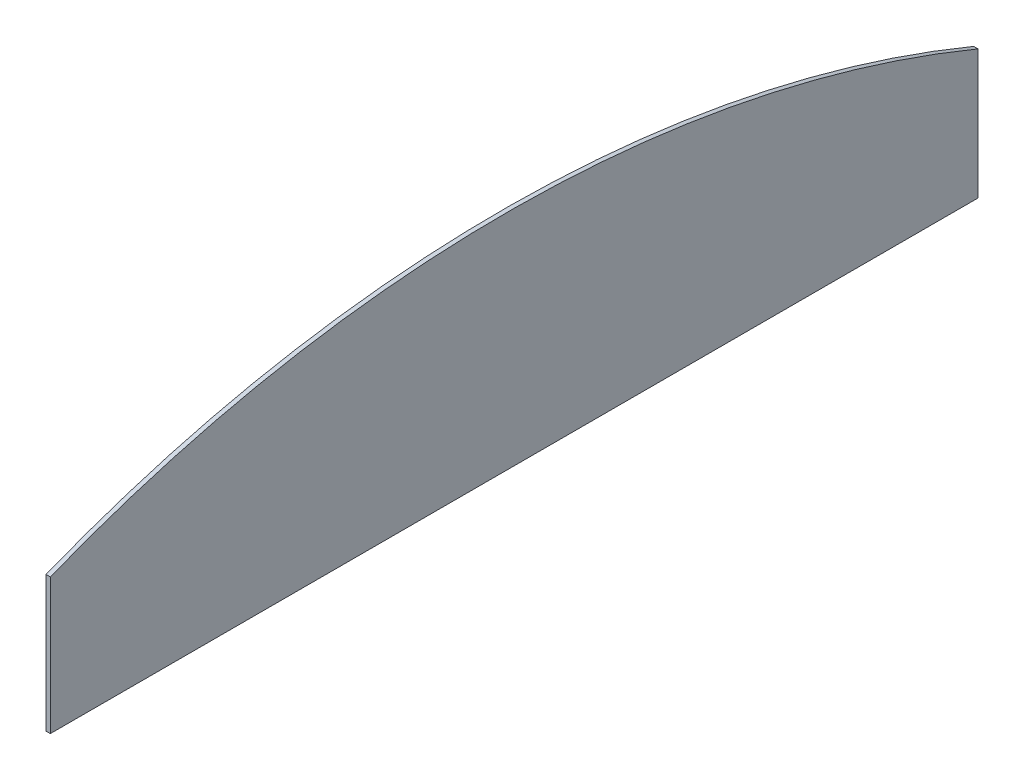
from build123d import *

# Parameters (mm, degrees)
BOSS_EXTRUDE1_DEPTH = 1.5


with BuildPart() as part:
    # Sketch1 → Boss-Extrude1 (new body)
    with BuildSketch(Plane(origin=(0, 0, 0), x_dir=(0, 0, -1), z_dir=(1, 0, 0))):
        with BuildLine():
            Line((162.774566474, 348.032089203), (-157.225433526, 348.032089203))
            Line((-157.225433526, 348.032089203), (-157.225433526, 394.848278523))
            ThreePointArc((-157.225433526, 394.848278523), (2.994918269, 424.989447474), (162.774566474, 392.593225246))
            Line((162.774566474, 392.593225246), (162.774566474, 348.032089203))
        make_face()
    extrude(amount=BOSS_EXTRUDE1_DEPTH)


solid = part.part
